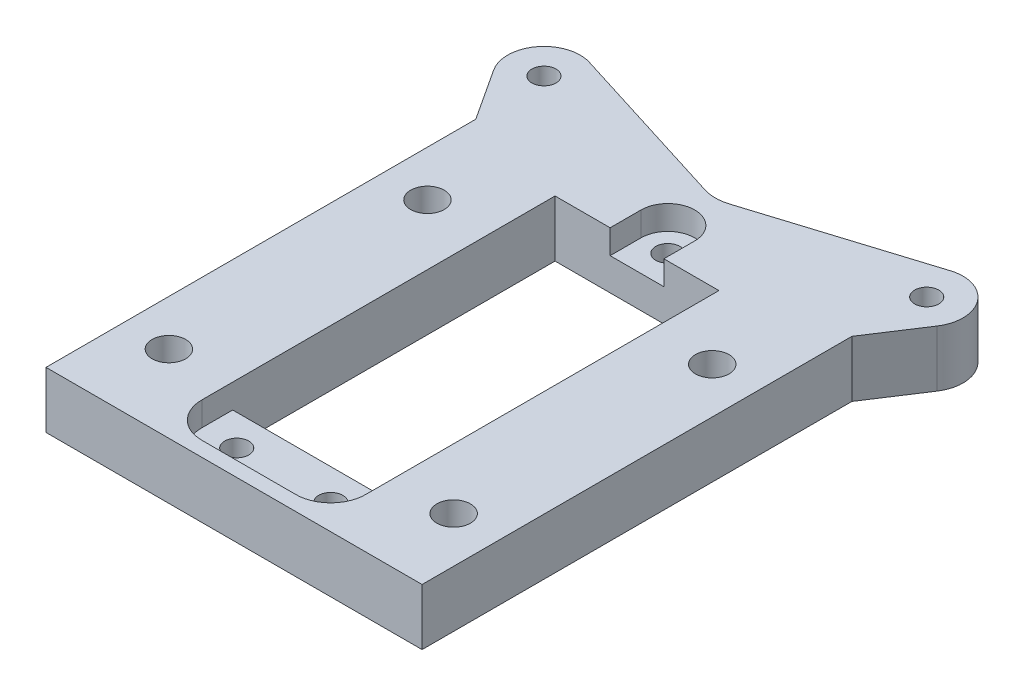
from build123d import *

# Parameters (mm, degrees)
SKETCH1_R           = 1.25
SKETCH1_R_2         = 0.9
SKETCH1_W           = 12.2
SKETCH1_H           = 24
BOSS_EXTRUDE2_DEPTH = 4.2
FILLET1_R           = 3
CUT_EXTRUDE1_DEPTH  = 1.8


with BuildPart() as part:
    # Sketch1 → Boss-Extrude2 (new body)
    with BuildSketch(Plane(origin=(0, 0, 0), x_dir=(1, 0, 0), z_dir=(0, 1, 0))):
        with BuildLine():
            Line((14, -18), (14, 14))
            Line((14, 14), (16.51058682, 17.844088419))
            ThreePointArc((16.51058682, 17.844088419), (16.382617975, 20.976365727), (13.379699555, 21.876375797))
            Line((13.379699555, 21.876375797), (0, 17.690906278))
            Line((0, 17.690906278), (-13.379699555, 21.876375797))
            ThreePointArc((-13.379699555, 21.876375797), (-16.382617975, 20.976365727), (-16.51058682, 17.844088419))
            Line((-16.51058682, 17.844088419), (-14, 14))
            Line((-14, 14), (-14, -18))
            Line((-14, -18), (14, -18))
        make_face()
        with Locations(Location((-10.6, 7, 0), (0, 0, 270))):
            Circle(SKETCH1_R, mode=Mode.SUBTRACT)
        with Locations(Location((-10.6, -12.25, 0), (0, 0, 270))):
            Circle(SKETCH1_R, mode=Mode.SUBTRACT)
        with Locations(Location((-3.5, -14.3, 0), (0, 0, 270))):
            Circle(SKETCH1_R_2, mode=Mode.SUBTRACT)
        with Locations(Location((3.5, -14.3, 0), (0, 0, 270))):
            Circle(SKETCH1_R_2, mode=Mode.SUBTRACT)
        with Locations(Location((10.6, -12.25, 0), (0, 0, 270))):
            Circle(SKETCH1_R, mode=Mode.SUBTRACT)
        with Locations(Location((10.6, 7, 0), (0, 0, 270))):
            Circle(SKETCH1_R, mode=Mode.SUBTRACT)
        with Locations(Location((0, 14.3, 0), (0, 0, 270))):
            Circle(SKETCH1_R_2, mode=Mode.SUBTRACT)
        with Locations(Location((-14.25, 19.320485123, 0), (0, 0, 270))):
            Circle(SKETCH1_R_2, mode=Mode.SUBTRACT)
        with Locations(Location((14.25, 19.320485123, 0), (0, 0, 270))):
            Circle(SKETCH1_R_2, mode=Mode.SUBTRACT)
        Rectangle(SKETCH1_W, SKETCH1_H, mode=Mode.SUBTRACT)
    extrude(amount=BOSS_EXTRUDE2_DEPTH)

    # Fillet1
    fillet1_edges = [part.edges().sort_by_distance(p)[0] for p in [
        (0, 2.1, -17.690906278),
    ]]
    fillet(fillet1_edges, radius=FILLET1_R)

    # Sketch2 → Cut-Extrude1 (cut)
    with BuildSketch(Plane(origin=(0, 4.2, 0), x_dir=(1, 0, 0), z_dir=(0, 1, 0))):
        with BuildLine():
            Line((-6.1, -12), (-6.1, -14.3))
            ThreePointArc((-6.1, -14.3), (-5.338477631, -16.138477631), (-3.5, -16.9))
            Line((-3.5, -16.9), (3.5, -16.9))
            ThreePointArc((3.5, -16.9), (5.338477631, -16.138477631), (6.1, -14.3))
            Line((6.1, -14.3), (6.1, -12))
            Line((6.1, -12), (-6.1, -12))
        make_face()
        with BuildLine():
            Line((-2, 14.3), (-2, 12))
            Line((-2, 12), (2, 12))
            Line((2, 12), (2, 14.3))
            ThreePointArc((2, 14.3), (0, 16.3), (-2, 14.3))
        make_face()
    extrude(amount=-CUT_EXTRUDE1_DEPTH, mode=Mode.SUBTRACT)


solid = part.part
